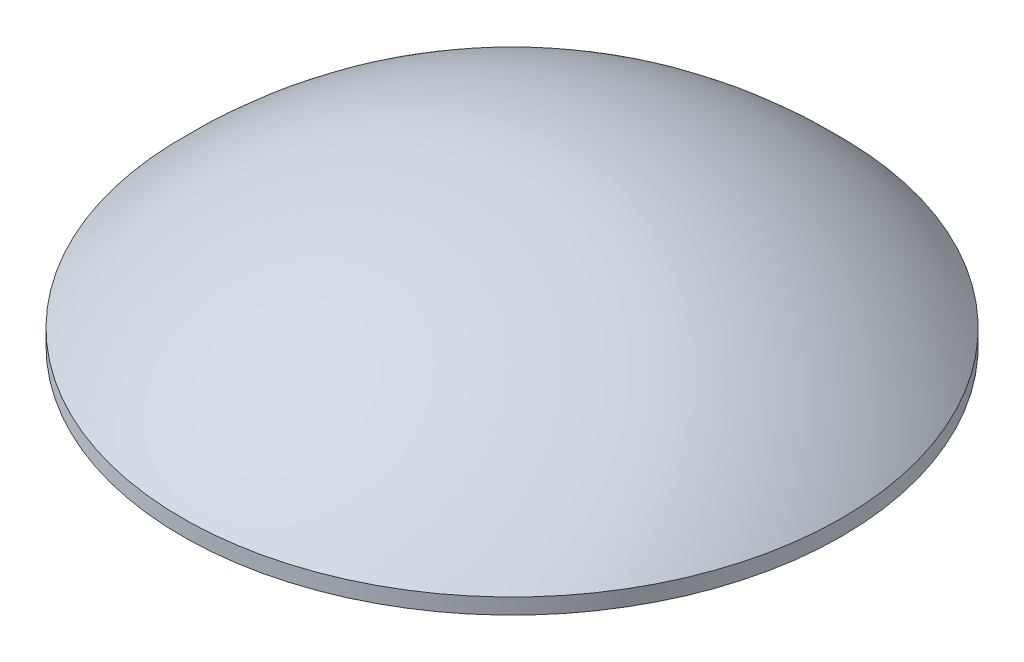
from build123d import *


with BuildPart() as part:
    # Эскиз1 → Повернуть1 (revolve)
    with BuildSketch(Plane.XY):
        with BuildLine():
            Line((0, 15), (0, 0))
            Line((0, 0), (31.5, 0))
            Line((31.5, 0), (31.5, 1.5))
            ThreePointArc((31.5, 1.5), (17.135489488, 11.482808806), (0, 15))
        make_face()
    revolve(axis=Axis((0, 0, 0), (0, 1, 0)))


solid = part.part
